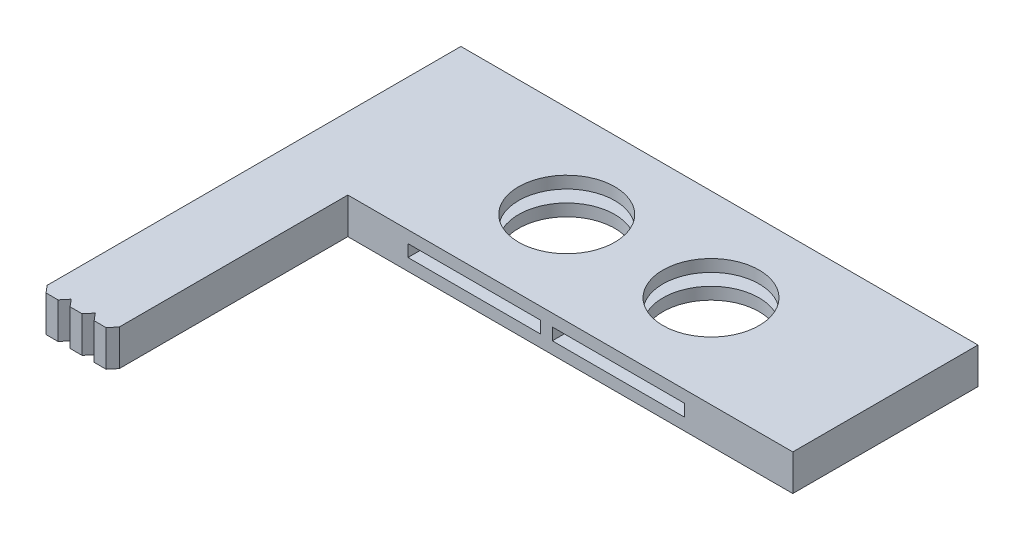
from build123d import *

# Parameters (mm, degrees)
SKETCH1_R           = 4
BOSS_EXTRUDE1_DEPTH = 3
SKETCH2_W           = 11
SKETCH2_H           = 1
CUT_EXTRUDE1_DEPTH  = 13.4


with BuildPart() as part:
    # Sketch1 → Boss-Extrude1 (new body)
    with BuildSketch(Plane(origin=(0, 0, 0), x_dir=(1, 0, 0), z_dir=(0, 1, 0))):
        Polygon((43, 7.7), (43, -7.7), (6, -7.7), (6, -26.7), (5.499093619, -27.3), (4.500906381, -27.3), (4, -26.7), (3.499093619, -27.3), (2.500906381, -27.3), (2, -26.7), (1.499093619, -27.3), (0.500906381, -27.3), (0, -26.7), (0, 7.7), align=None)
        with Locations(Location((16.5, 0, 0), (0, 0, 270))):
            Circle(SKETCH1_R, mode=Mode.SUBTRACT)
        with Locations(Location((28.5, 0, 0), (0, 0, 270))):
            Circle(SKETCH1_R, mode=Mode.SUBTRACT)
    extrude(amount=BOSS_EXTRUDE1_DEPTH)

    # Sketch2 → Cut-Extrude1 (cut)
    with BuildSketch(Plane.XY.offset(7.7)):
        with Locations((16.5, 1.5)):
            Rectangle(SKETCH2_W, SKETCH2_H)
        with Locations((28.5, 1.5)):
            Rectangle(SKETCH2_W, SKETCH2_H)
    extrude(amount=-CUT_EXTRUDE1_DEPTH, mode=Mode.SUBTRACT)


solid = part.part
